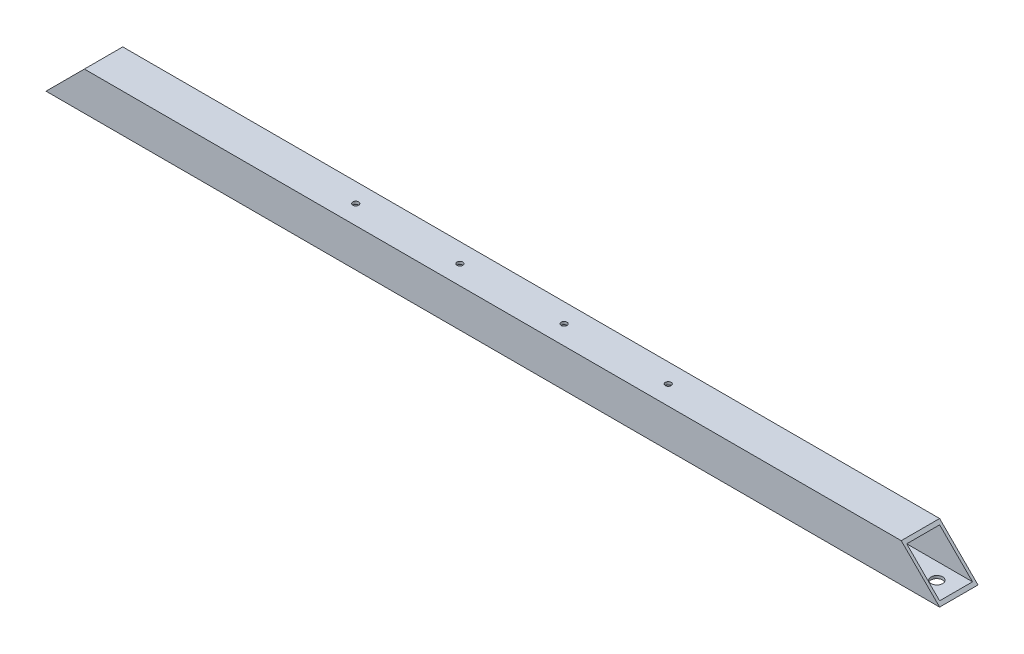
from build123d import *

# Parameters (mm, degrees)
SKETCH1_W               = 44.45
SKETCH1_H               = 44.45
SKETCH1_W_2             = 38.1
SKETCH1_H_2             = 38.1
BOSS_EXTRUDE1_DEPTH     = 1035.05
CUT_EXTRUDE1_DEPTH      = 1037.242373012
F_1_2_CLEARANCE_HOLE1_D = 13.49248
F_1_4_CLEARANCE_HOLE1_D = 6.7564


with BuildPart() as part:
    # Sketch1 → Boss-Extrude1 (new body)
    with BuildSketch(Plane(origin=(0, 0, 0), x_dir=(0, 0, -1), z_dir=(1, 0, 0))):
        Rectangle(SKETCH1_W, SKETCH1_H)
        Rectangle(SKETCH1_W_2, SKETCH1_H_2, mode=Mode.SUBTRACT)
    extrude(amount=BOSS_EXTRUDE1_DEPTH)

    # Sketch2 → Cut-Extrude1 (cut, through all)
    with BuildSketch(Plane.XY.offset(22.225)):
        Polygon((0, 22.225), (0, -22.225), (44.45, 22.225), align=None)
        Polygon((990.6, 22.225), (1035.05, 22.225), (1035.05, -22.225), align=None)
    extrude(amount=-CUT_EXTRUDE1_DEPTH, mode=Mode.SUBTRACT)

    # 1/2 Clearance Hole1 (through all)
    with Locations(Plane(origin=(0, -22.225, 0), x_dir=(-1, 0, 0), z_dir=(0, -1, 0))):
        with Locations((-25.4, 0), (-1009.65, 0)):
            Hole(F_1_2_CLEARANCE_HOLE1_D / 2)

    # 1/4 Clearance Hole1 (through all)
    with Locations(Plane(origin=(0, 22.225, 0), x_dir=(1, 0, 0), z_dir=(0, 1, 0))):
        with Locations((336.55, 0), (457.2, 0), (577.85, 0), (698.5, 0)):
            Hole(F_1_4_CLEARANCE_HOLE1_D / 2)


solid = part.part
